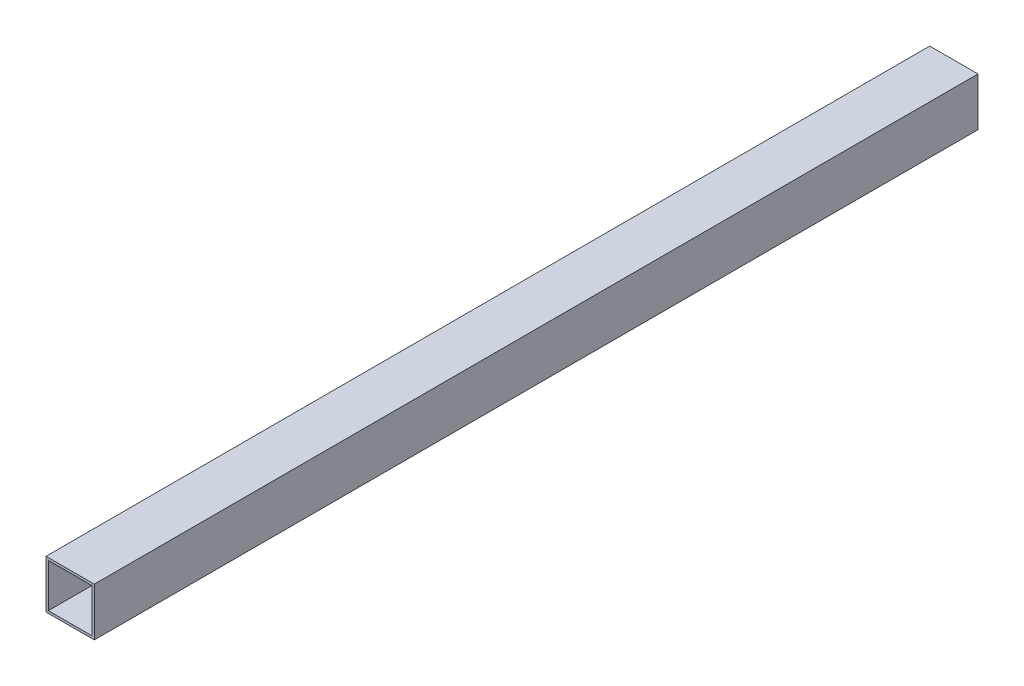
from build123d import *

# Parameters (mm, degrees)
ESQUISSE1_W        = 1000
ESQUISSE1_H        = 1000
ESQUISSE1_W_2      = 900
ESQUISSE1_H_2      = 900
BOSS_EXTRU_1_DEPTH = 18300


with BuildPart() as part:
    # Esquisse1 → Boss.-Extru.1 (new body)
    with BuildSketch(Plane.XY):
        Rectangle(ESQUISSE1_W, ESQUISSE1_H)
        Rectangle(ESQUISSE1_W_2, ESQUISSE1_H_2, mode=Mode.SUBTRACT)
    extrude(amount=BOSS_EXTRU_1_DEPTH)


solid = part.part
